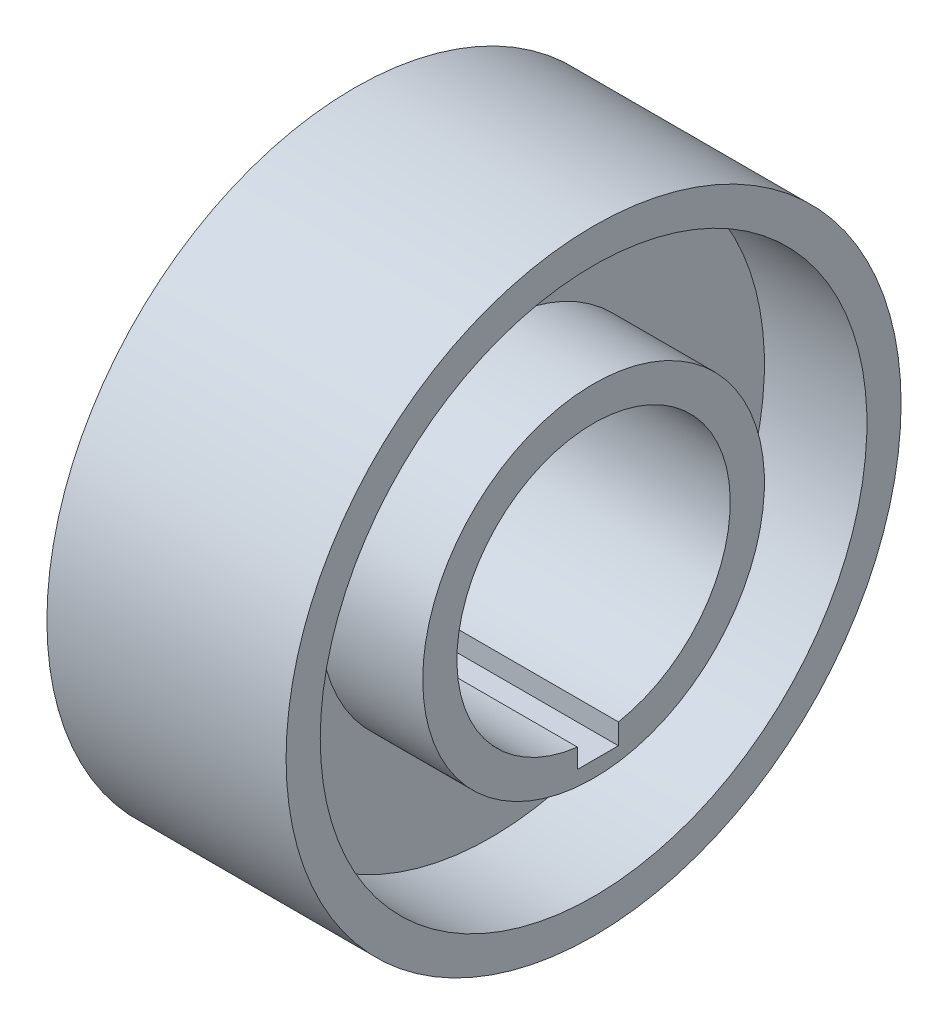
from build123d import *

# Parameters (mm, degrees)
CUT_EXTRUDE1_START = -35
CUT_EXTRUDE1_DEPTH = 35
CUT_EXTRUDE2_DEPTH = 35


with BuildPart() as part:
    # Sketch2 → Revolve3 (revolve)
    with BuildSketch(Plane(origin=(0, 0, 0), x_dir=(1, 0, 0), z_dir=(0, 1, 0)), mode=Mode.PRIVATE) as revolve3_sk:
        Polygon((35, 20), (0, 20), (0, 25), (15, 25), (15, 40), (0, 40), (0, 45), (35, 45), (35, 40), (20, 40), (20, 25), (35, 25), align=None)
    revolve(revolve3_sk.sketch.rotate(Axis((0, 0, 0), (1, 0, 0)), 180), axis=Axis((0, 0, 0), (1, 0, 0)))

    # Sketch5 → Cut-Extrude1 (cut)
    with BuildSketch(Plane(origin=(35, 0, 0), x_dir=(0, 0, -1), z_dir=(1, 0, 0)).offset(CUT_EXTRUDE1_START)):
        with BuildLine():
            Line((-2.36724254, -19.85940993), (-2.36724254, -22.690863933))
            Line((-2.36724254, -22.690863933), (3.63275746, -22.690863933))
            Line((3.63275746, -22.690863933), (3.63275746, -19.85940993))
            Line((3.63275746, -19.85940993), (2.36724254, -19.85940993))
            ThreePointArc((2.36724254, -19.85940993), (0, -20), (-2.36724254, -19.85940993))
        make_face()
    extrude(amount=CUT_EXTRUDE1_DEPTH, mode=Mode.SUBTRACT)

    # Sketch6 → Cut-Extrude2 (cut)
    with BuildSketch(Plane(origin=(35, 0, 0), x_dir=(0, 0, -1), z_dir=(1, 0, 0))):
        Polygon((3.63275746, -19.85940993), (3.63275746, -19.592754897), (2.36724254, -19.85940993), align=None)
    extrude(amount=-CUT_EXTRUDE2_DEPTH, mode=Mode.SUBTRACT)


solid = part.part
